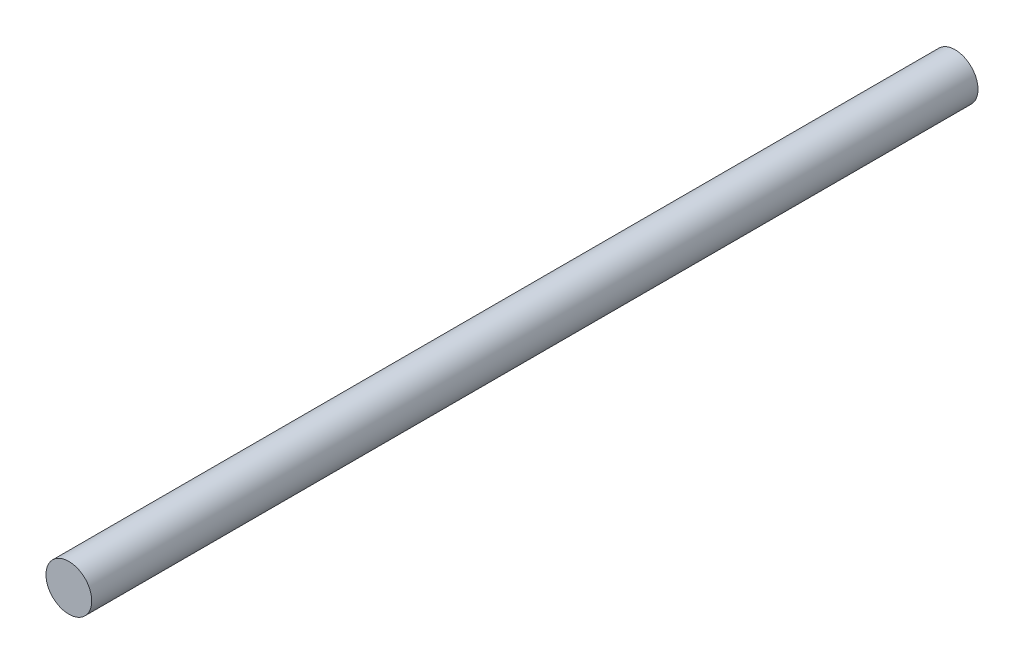
from build123d import *

# Parameters (mm, degrees)
CROQUIS1_R              = 31
SALIENTE_EXTRUIR1_DEPTH = 1200


with BuildPart() as part:
    # Croquis1 → Saliente-Extruir1 (new body)
    with BuildSketch(Plane.XY):
        with Locations((-61.281459379, 29.695808737)):
            Circle(CROQUIS1_R)
    extrude(amount=SALIENTE_EXTRUIR1_DEPTH)


solid = part.part
